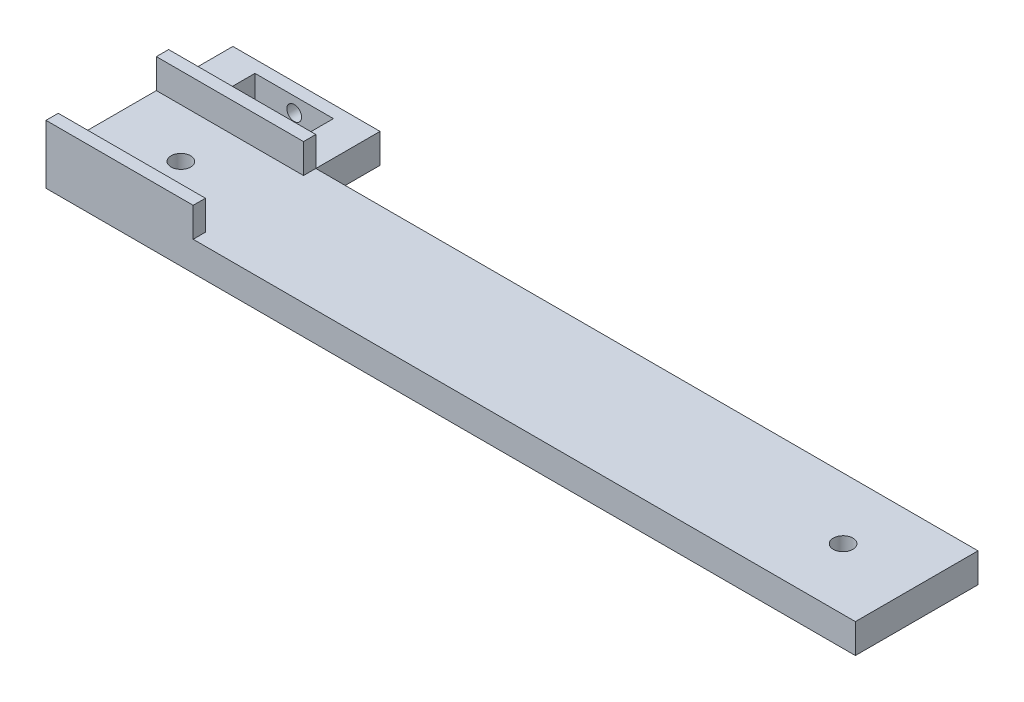
from build123d import *

# Parameters (mm, degrees)
SKETCH1_R           = 2
SKETCH1_W           = 16
SKETCH1_H           = 10.6
BOSS_EXTRUDE1_DEPTH = 6
SKETCH1_3_W         = 30
SKETCH1_3_H         = 2.5
BOSS_EXTRUDE2_DEPTH = 12
SKETCH3_R           = 1.5
CUT_EXTRUDE2_DEPTH  = 5
CUT_EXTRUDE3_DEPTH  = 2.5
SKETCH2_R           = 2
CUT_EXTRUDE1_DEPTH  = 137.99361299


with BuildPart() as part:
    # Sketch1 → Boss-Extrude1 (new body)
    with BuildSketch(Plane(origin=(0, 0, 0), x_dir=(1, 0, 0), z_dir=(0, 1, 0))):
        Polygon((135, 2.5), (0, 2.5), (0, 15.6), (-30, 15.6), (-30, -22.5), (135, -22.5), align=None)
        with Locations((120, -10)):
            Circle(SKETCH1_R, mode=Mode.SUBTRACT)
        with Locations((-15, 7.8)):
            Rectangle(SKETCH1_W, SKETCH1_H, mode=Mode.SUBTRACT)
    extrude(amount=BOSS_EXTRUDE1_DEPTH)

    # Sketch1<3> → Boss-Extrude2 (add)
    with BuildSketch(Plane(origin=(0, 0, 0), x_dir=(1, 0, 0), z_dir=(0, 1, 0))):
        with Locations((-15, -21.25)):
            Rectangle(SKETCH1_3_W, SKETCH1_3_H)
        with Locations((-15, 1.25)):
            Rectangle(SKETCH1_3_W, SKETCH1_3_H)
    extrude(amount=BOSS_EXTRUDE2_DEPTH)

    # Sketch3 → Cut-Extrude2 (cut)
    with BuildSketch(Plane(origin=(0, 0, -15.6), x_dir=(-1, 0, 0), z_dir=(0, 0, -1))):
        with Locations((15, 3)):
            Circle(SKETCH3_R)
    extrude(amount=-CUT_EXTRUDE2_DEPTH, mode=Mode.SUBTRACT)

    # Sketch4 → Cut-Extrude3 (cut)
    with BuildSketch(Plane(origin=(0, 0, -2.5), x_dir=(-1, 0, 0), z_dir=(0, 0, -1))):
        Polygon((16.443375673, 0.5), (17.886751346, 3), (16.443375673, 5.5), (13.556624327, 5.5), (12.113248654, 3), (13.556624327, 0.5), align=None)
    extrude(amount=-CUT_EXTRUDE3_DEPTH, mode=Mode.SUBTRACT)

    # Sketch2 → Cut-Extrude1 (cut, through all)
    with BuildSketch(Plane(origin=(0, 6, 0), x_dir=(1, 0, 0), z_dir=(0, 1, 0))):
        with Locations((-15, -10)):
            Circle(SKETCH2_R)
    extrude(amount=-CUT_EXTRUDE1_DEPTH, mode=Mode.SUBTRACT)


solid = part.part
